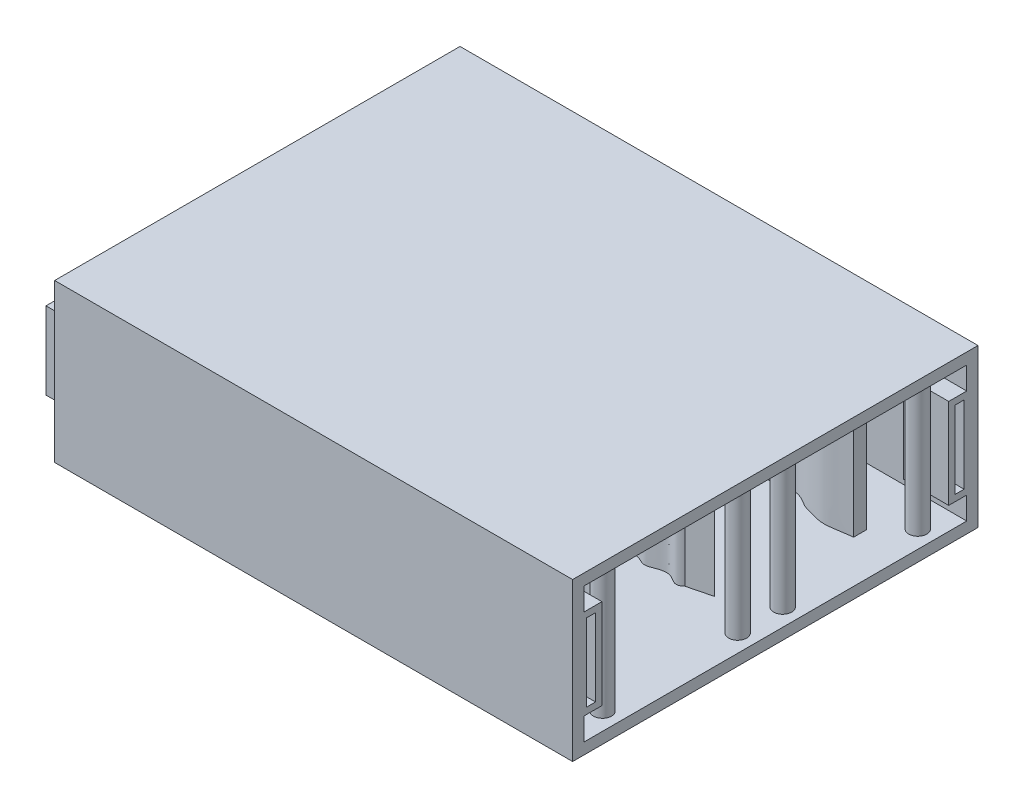
from build123d import *

# Parameters (mm, degrees)
SKETCH_1_W             = 115
SKETCH_1_H             = 90
EXTRUDE_1_DEPTH        = 35
SKETCH_2_W             = 85
SKETCH_2_H             = 30
CUT_EXTRUDE_1_DEPTH    = 129.35497653
SKETCH_3_W             = 4
SKETCH_3_H             = 20
EXTRUDE_2_DEPTH        = 10
PATTERN_LINEAR_1_COUNT = 2
PATTERN_LINEAR_1_PITCH = 105
SKETCH_4_W             = 2
SKETCH_4_H             = 17.171572876
SKETCH_4_W_2           = 2.00420305
EXTRUDE_3_DEPTH        = 5
SKETCH_5_W             = 2
SKETCH_5_H             = 17.171572876
CUT_EXTRUDE_2_DEPTH    = 5
EXTRUDE_4_DEPTH        = 32
SKETCH_7_R             = 2
SKETCH_7_R_2           = 3
EXTRUDE_5_DEPTH        = 32


with BuildPart() as part:
    # Эскиз1 → Бобышка-Вытянуть1 (new body)
    with BuildSketch(Plane(origin=(0, 0, 0), x_dir=(1, 0, 0), z_dir=(0, 1, 0))):
        Rectangle(SKETCH_1_W, SKETCH_1_H)
    extrude(amount=EXTRUDE_1_DEPTH)

    # Эскиз2 → Вырез-Вытянуть1 (cut, through all)
    with BuildSketch(Plane(origin=(57.5, 0, 0), x_dir=(0, 0, -1), z_dir=(1, 0, 0))):
        with Locations((0, 17.5)):
            Rectangle(SKETCH_2_W, SKETCH_2_H)
    extrude(amount=-CUT_EXTRUDE_1_DEPTH, mode=Mode.SUBTRACT)

    # Эскиз3 → Бобышка-Вытянуть2 (add)
    with BuildSketch(Plane(origin=(57.5, 0, 0), x_dir=(0, 0, -1), z_dir=(1, 0, 0))):
        with Locations((40.5, 17.5)):
            Rectangle(SKETCH_3_W, SKETCH_3_H)
        with Locations((-40.5, 17.5)):
            Rectangle(SKETCH_3_W, SKETCH_3_H)
    extrude_2 = extrude(amount=-EXTRUDE_2_DEPTH)

    # Линейный массив1: Бобышка-Вытянуть2 ×2
    with Locations(*[(-i * PATTERN_LINEAR_1_PITCH, 0, 0) for i in range(1, PATTERN_LINEAR_1_COUNT)]):
        add(extrude_2)

    # Эскиз4 → Бобышка-Вытянуть3 (add)
    with BuildSketch(Plane.ZY.offset(57.5)):
        with Locations((-40.914213562, 17.5)):
            Rectangle(SKETCH_4_W, SKETCH_4_H)
        with Locations((40.916315087, 17.5)):
            Rectangle(SKETCH_4_W_2, SKETCH_4_H)
    extrude(amount=EXTRUDE_3_DEPTH)

    # Эскиз5 → Вырез-Вытянуть2 (cut)
    with BuildSketch(Plane(origin=(57.5, 0, 0), x_dir=(0, 0, -1), z_dir=(1, 0, 0))):
        Polygon((-41.914213562, 8.914213562), (-39.914213562, 8.914213562), (-39.914213562, 26.085786438), (-41.861464641, 26.085786438), (-41.914213562, 26.085786438), align=None)
        with Locations((40.914213562, 17.5)):
            Rectangle(SKETCH_5_W, SKETCH_5_H)
    extrude(amount=-CUT_EXTRUDE_2_DEPTH, mode=Mode.SUBTRACT)

    # Эскиз6 → Бобышка-Вытянуть4 (add)
    with BuildSketch(Plane(origin=(0, 2.5, 0), x_dir=(1, 0, 0), z_dir=(0, 1, 0))):
        with BuildLine():
            Line((-46.043296894, 8.241245457), (-46.043296894, 6.420954051))
            add(Edge.make_bspline(
                [(-46.043296894, 6.420954051), (-45.567643463, 6.783022462), (-44.418273742, 6.663499627), (-42.596827193, 6.251952859), (-40.67548381, 6.861862235), (-38.946987775, 7.548636617), (-37.371717017, 8.272783436), (-35.922201481, 9.135821817), (-34.368016106, 9.795095903), (-32.552408007, 10.236460738), (-30.875091127, 10.484125662), (-29.205660096, 10.074620816), (-27.722096002, 9.728762757), (-26.032623992, 9.172746637), (-24.419031869, 8.156022377), (-22.579655331, 7.497879251), (-20.512401623, 7.651061012), (-18.423652079, 7.703775967), (-16.431018594, 8.851733962), (-14.536659135, 9.687773527), (-12.933197131, 10.920482526), (-10.759226742, 11.516117933), (-9.086877089, 11.369885899), (-8.158168523, 10.824322392)],
                knots=[0, 0, 0, 0, 0.04168607, 0.08266213, 0.139028276, 0.18702372, 0.223119688, 0.268385996, 0.313303945, 0.348627352, 0.408584037, 0.43702706, 0.476454333, 0.522985936, 0.568955219, 0.619169831, 0.665388669, 0.723193465, 0.772337825, 0.834417808, 0.878554457, 0.921772156, 1, 1, 1, 1], degree=3))
            Line((-8.158168523, 10.824322392), (-8.158168523, 11.8083517))
            add(Edge.make_bspline(
                [(-46.043296894, 8.241245457), (-43.742119113, 7.071241643), (-39.478417174, 8.257183991), (-34.007827526, 11.384259695), (-27.99354441, 11.733099997), (-23.002598387, 8.365811277), (-15.501085119, 8.856023709), (-11.937050053, 13.559055067), (-8.158168523, 11.8083517)],
                knots=[0, 0, 0, 0, 0.182780883, 0.315256071, 0.48343186, 0.602003071, 0.761083045, 1, 1, 1, 1], degree=3))
        make_face()
        with BuildLine():
            Line((-46.043296894, -8.241245457), (-46.043296894, -6.420954051))
            add(Edge.make_bspline(
                [(-46.043296894, -6.420954051), (-45.567643463, -6.783022462), (-44.418273742, -6.663499627), (-42.596827193, -6.251952859), (-40.67548381, -6.861862235), (-38.946987775, -7.548636617), (-37.371717017, -8.272783436), (-35.922201481, -9.135821817), (-34.368016106, -9.795095903), (-32.552408007, -10.236460738), (-30.875091127, -10.484125662), (-29.205660096, -10.074620816), (-27.722096002, -9.728762757), (-26.032623992, -9.172746637), (-24.419031869, -8.156022377), (-22.579655331, -7.497879251), (-20.512401623, -7.651061012), (-18.423652079, -7.703775967), (-16.431018594, -8.851733962), (-14.536659135, -9.687773527), (-12.933197131, -10.920482526), (-10.759226742, -11.516117933), (-9.086877089, -11.369885899), (-8.158168523, -10.824322392)],
                knots=[0, 0, 0, 0, 0.04168607, 0.08266213, 0.139028276, 0.18702372, 0.223119688, 0.268385996, 0.313303945, 0.348627352, 0.408584037, 0.43702706, 0.476454333, 0.522985936, 0.568955219, 0.619169831, 0.665388669, 0.723193465, 0.772337825, 0.834417808, 0.878554457, 0.921772156, 1, 1, 1, 1], degree=3))
            Line((-8.158168523, -10.824322392), (-8.158168523, -11.8083517))
            add(Edge.make_bspline(
                [(-46.043296894, -8.241245457), (-43.742119113, -7.071241643), (-39.478417174, -8.257183991), (-34.007827526, -11.384259695), (-27.99354441, -11.733099997), (-23.002598387, -8.365811277), (-15.501085119, -8.856023709), (-11.937050053, -13.559055067), (-8.158168523, -11.8083517)],
                knots=[0, 0, 0, 0, 0.182780883, 0.315256071, 0.48343186, 0.602003071, 0.761083045, 1, 1, 1, 1], degree=3))
        make_face()
        with BuildLine():
            Line((3.035164859, 28.659853605), (3.035164859, 26.801248577))
            add(Edge.make_bspline(
                [(3.035164859, 26.801248577), (4.532714923, 27.586620137), (6.4341137, 29.065358615), (9.092953302, 28.99824055), (10.226576923, 28.456214596), (11.466454743, 28.243085697), (12.730594815, 27.794593214), (14.259271575, 27.290644911), (16.012206695, 26.465026902), (18.223291266, 26.148310538), (20.646206728, 25.848557441), (22.999487726, 26.301467242), (25.282526415, 27.062740998), (27.169739445, 28.299979522), (29.209800208, 28.895148716), (31.198806524, 29.055786796), (33.231530628, 29.152032736), (35.10442842, 28.38009485), (36.754411623, 27.204353658), (38.797561955, 26.857463603), (41.001141362, 26.053927108), (44.20572622, 26.128719721), (46.507573039, 26.719017608), (48.054505716, 26.801248577)],
                knots=[0, 0, 0, 0, 0.110986633, 0.140255949, 0.164302691, 0.190200406, 0.22004054, 0.249700109, 0.292931879, 0.342679457, 0.391189299, 0.447844464, 0.493595854, 0.543980631, 0.590584648, 0.627097516, 0.671558369, 0.718423063, 0.75304665, 0.799494483, 0.848039494, 0.901887625, 1, 1, 1, 1], degree=3))
            Line((48.054505716, 26.801248577), (48.054505716, 29.643882914))
            add(Edge.make_bspline(
                [(3.035164859, 28.659853605), (5.730829028, 30.335716894), (11.305608318, 31.225143604), (17.909495858, 26.710323554), (24.746041705, 28.123719448), (31.242065021, 31.567225135), (38.864162526, 27.688613571), (45.027880454, 26.802176107), (48.054505716, 29.643882914)],
                knots=[0, 0, 0, 0, 0.205732636, 0.319850996, 0.488895794, 0.620938361, 0.76556468, 1, 1, 1, 1], degree=3))
        make_face()
        with BuildLine():
            Line((3.035164859, -28.659853605), (3.035164859, -26.801248577))
            add(Edge.make_bspline(
                [(3.035164859, -26.801248577), (4.532714923, -27.586620137), (6.4341137, -29.065358615), (9.092953302, -28.99824055), (10.226576923, -28.456214596), (11.466454743, -28.243085697), (12.730594815, -27.794593214), (14.259271575, -27.290644911), (16.012206695, -26.465026902), (18.223291266, -26.148310538), (20.646206728, -25.848557441), (22.999487726, -26.301467242), (25.282526415, -27.062740998), (27.169739445, -28.299979522), (29.209800208, -28.895148716), (31.198806524, -29.055786796), (33.231530628, -29.152032736), (35.10442842, -28.38009485), (36.754411623, -27.204353658), (38.797561955, -26.857463603), (41.001141362, -26.053927108), (44.20572622, -26.128719721), (46.507573039, -26.719017608), (48.054505716, -26.801248577)],
                knots=[0, 0, 0, 0, 0.110986633, 0.140255949, 0.164302691, 0.190200406, 0.22004054, 0.249700109, 0.292931879, 0.342679457, 0.391189299, 0.447844464, 0.493595854, 0.543980631, 0.590584648, 0.627097516, 0.671558369, 0.718423063, 0.75304665, 0.799494483, 0.848039494, 0.901887625, 1, 1, 1, 1], degree=3))
            Line((48.054505716, -26.801248577), (48.054505716, -29.643882914))
            add(Edge.make_bspline(
                [(3.035164859, -28.659853605), (5.730829028, -30.335716894), (11.305608318, -31.225143604), (17.909495858, -26.710323554), (24.746041705, -28.123719448), (31.242065021, -31.567225135), (38.864162526, -27.688613571), (45.027880454, -26.802176107), (48.054505716, -29.643882914)],
                knots=[0, 0, 0, 0, 0.205732636, 0.319850996, 0.488895794, 0.620938361, 0.76556468, 1, 1, 1, 1], degree=3))
        make_face()
        with BuildLine():
            Line((38.742743859, 1.331545287), (43.995384819, 0))
            Line((43.995384819, 0), (38.742743859, -1.331545287))
            add(Edge.make_bspline(
                [(5.305742756, -0.940264608), (5.963497958, -1.531591705), (7.39451162, -1.951984153), (9.401490927, -1.300553872), (11.164920571, -1.294864479), (12.979033343, -2.173347638), (14.812873929, -2.010458965), (16.526687769, -1.227077053), (18.360986799, -0.898432994), (20.483813805, -0.668878077), (22.142057451, -1.803166663), (24.055925539, -2.138323207), (25.765051478, -1.145134943), (27.920174603, -0.58434972), (30.117746062, -2.231600428), (32.533842398, -0.756521758), (35.794328111, -0.547924566), (37.280159625, -2.698738676), (38.742743859, -1.331545287)],
                knots=[0, 0, 0, 0, 0.0762801, 0.116787759, 0.181740691, 0.222476037, 0.288888195, 0.331770975, 0.385341801, 0.451021368, 0.5071825, 0.554429147, 0.60958632, 0.674865131, 0.733612513, 0.820118945, 0.891780971, 1, 1, 1, 1], degree=3))
            Line((5.305742756, -0.940264608), (1.710269617, 0))
            Line((1.710269617, 0), (5.305742756, 0.940264608))
            add(Edge.make_bspline(
                [(5.305742756, 0.940264608), (5.963497958, 1.531591705), (7.39451162, 1.951984153), (9.401490927, 1.300553872), (11.164920571, 1.294864479), (12.979033343, 2.173347638), (14.812873929, 2.010458965), (16.526687769, 1.227077053), (18.360986799, 0.898432994), (20.483813805, 0.668878077), (22.142057451, 1.803166663), (24.055925539, 2.138323207), (25.765051478, 1.145134943), (27.920174603, 0.58434972), (30.117746062, 2.231600428), (32.533842398, 0.756521758), (35.794328111, 0.547924566), (37.280159625, 2.698738676), (38.742743859, 1.331545287)],
                knots=[0, 0, 0, 0, 0.0762801, 0.116787759, 0.181740691, 0.222476037, 0.288888195, 0.331770975, 0.385341801, 0.451021368, 0.5071825, 0.554429147, 0.60958632, 0.674865131, 0.733612513, 0.820118945, 0.891780971, 1, 1, 1, 1], degree=3))
        make_face()
    extrude(amount=EXTRUDE_4_DEPTH)

    # Эскиз7 → Бобышка-Вытянуть5 (add)
    with BuildSketch(Plane(origin=(0, 2.5, 0), x_dir=(1, 0, 0), z_dir=(0, 1, 0))):
        with Locations(Location((-54.161538688, 35.548058764, 0), (0, 0, 90))):
            Circle(SKETCH_7_R)
        with Locations(Location((-54.161538688, 5.548058764, 0), (0, 0, 90))):
            Circle(SKETCH_7_R)
        with Locations(Location((-54.161538688, -4.451941236, 0), (0, 0, 90))):
            Circle(SKETCH_7_R)
        with Locations(Location((-39.161538688, 35.548058764, 0), (0, 0, 90))):
            Circle(SKETCH_7_R)
        with Locations(Location((-9.161538688, 35.548058764, 0), (0, 0, 90))):
            Circle(SKETCH_7_R)
        with Locations(Location((5.838461312, 35.548058764, 0), (0, 0, 90))):
            Circle(SKETCH_7_R)
        with Locations(Location((35.838461312, 35.548058764, 0), (0, 0, 90))):
            Circle(SKETCH_7_R)
        with Locations(Location((-54.161538688, -34.451941236, 0), (0, 0, 90))):
            Circle(SKETCH_7_R)
        with Locations(Location((-39.161538688, -34.451941236, 0), (0, 0, 90))):
            Circle(SKETCH_7_R)
        with Locations(Location((-9.161538688, -34.451941236, 0), (0, 0, 90))):
            Circle(SKETCH_7_R)
        with Locations(Location((5.838461312, -34.451941236, 0), (0, 0, 90))):
            Circle(SKETCH_7_R)
        with Locations(Location((35.838461312, -34.451941236, 0), (0, 0, 90))):
            Circle(SKETCH_7_R)
        with Locations(Location((53.589670575, 35.548058764, 0), (0, 0, 90))):
            Circle(SKETCH_7_R)
        with Locations(Location((53.589670575, 5.548058764, 0), (0, 0, 90))):
            Circle(SKETCH_7_R)
        with Locations(Location((53.589670575, -4.451941236, 0), (0, 0, 90))):
            Circle(SKETCH_7_R)
        with Locations(Location((53.589670575, -34.451941236, 0), (0, 0, 90))):
            Circle(SKETCH_7_R)
        with Locations(Location((-22.795604484, 20.541611812, 0), (0, 0, 90))):
            Circle(SKETCH_7_R_2)
        with Locations(Location((-22.795604484, -20.418608148, 0), (0, 0, 90))):
            Circle(SKETCH_7_R_2)
    extrude(amount=EXTRUDE_5_DEPTH)


solid = part.part
